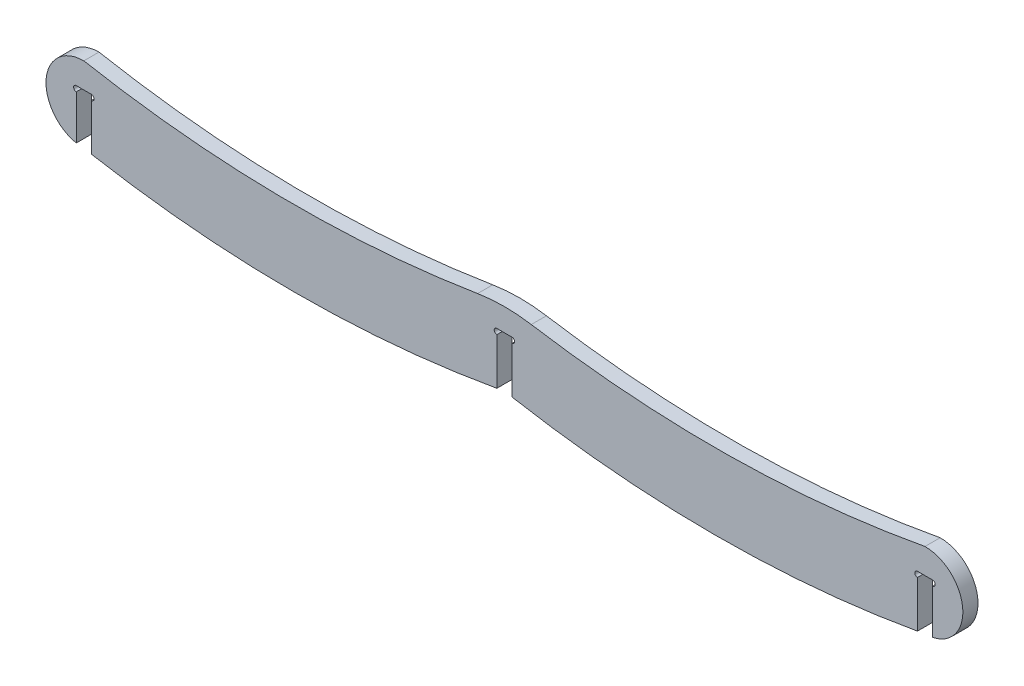
from build123d import *

# Parameters (mm, degrees)
ESTRUSIONE_ESTRUSIONE1_DEPTH = 18
RACCORDO1_R                  = 200


with BuildPart() as part:
    # Schizzo1 → Estrusione-Estrusione1 (new body)
    with BuildSketch(Plane.XY):
        with BuildLine():
            ThreePointArc((-66.988913829, 53.65), (-70.163913829, 56.825), (-66.988913829, 60))
            Line((-66.988913829, 60), (-48.988913829, 60))
            ThreePointArc((-48.988913829, 60), (-45.813913829, 56.825), (-48.988913829, 53.65))
            Line((-48.988913829, 53.65), (-48.988913829, 0.90918463))
            ThreePointArc((-48.988913829, 0.90918463), (-23.132063713, 16.539501058), (-12.988913829, 45))
            ThreePointArc((-12.988913829, 45), (-21.036068748, 70.680483648), (-42.299457846, 87.176308171))
            ThreePointArc((-42.299457846, 87.176308171), (-50.148301569, 88.565285591), (-57.988913829, 90))
            ThreePointArc((-57.988913829, 90), (-102.761040714, 49.52290329), (-66.988913829, 0.90918463))
            Line((-66.988913829, 0.90918463), (-66.988913829, 53.65))
        make_face()
        with BuildLine():
            ThreePointArc((-12.988913829, 45), (-23.132063713, 16.539501058), (-48.988913829, 0.90918463))
            Line((-48.988913829, 0.90918463), (-48.988913829, -1.642858287))
            ThreePointArc((-48.988913829, -1.642858287), (192.011086171, -23.052237245), (433.011086171, -1.642858287))
            Line((433.011086171, -1.642858287), (433.011086171, 0.90918463))
            ThreePointArc((433.011086171, 0.90918463), (397.145771503, 41.520985802), (426.321630188, 87.176308171))
            ThreePointArc((426.321630188, 87.176308171), (192.011086171, 66.947762755), (-42.299457846, 87.176308171))
            ThreePointArc((-42.299457846, 87.176308171), (-21.036068748, 70.680483648), (-12.988913829, 45))
        make_face()
        with BuildLine():
            ThreePointArc((442.011086171, 90), (434.17047391, 88.565285591), (426.321630188, 87.176308171))
            ThreePointArc((426.321630188, 87.176308171), (397.145771503, 41.520985802), (433.011086171, 0.90918463))
            Line((433.011086171, 0.90918463), (433.011086171, 53.65))
            ThreePointArc((433.011086171, 53.65), (429.836086171, 56.825), (433.011086171, 60))
            Line((433.011086171, 60), (451.011086171, 60))
            ThreePointArc((451.011086171, 60), (454.186086171, 56.825), (451.011086171, 53.65))
            Line((451.011086171, 53.65), (451.011086171, 0.90918463))
            ThreePointArc((451.011086171, 0.90918463), (476.867936287, 16.539501058), (487.011086171, 45))
            ThreePointArc((487.011086171, 45), (478.963931252, 70.680483648), (457.700542154, 87.176308171))
            ThreePointArc((457.700542154, 87.176308171), (449.851698431, 88.565285591), (442.011086171, 90))
        make_face()
        with BuildLine():
            ThreePointArc((487.011086171, 45), (476.867936287, 16.539501058), (451.011086171, 0.90918463))
            Line((451.011086171, 0.90918463), (451.011086171, -1.642858287))
            ThreePointArc((451.011086171, -1.642858287), (692.011086171, -23.052237245), (933.011086171, -1.642858287))
            Line((933.011086171, -1.642858287), (933.011086171, 0.90918463))
            ThreePointArc((933.011086171, 0.90918463), (897.145771503, 41.520985802), (926.321630188, 87.176308171))
            ThreePointArc((926.321630188, 87.176308171), (692.011086171, 66.947762755), (457.700542154, 87.176308171))
            ThreePointArc((457.700542154, 87.176308171), (478.963931252, 70.680483648), (487.011086171, 45))
        make_face()
        with BuildLine():
            ThreePointArc((942.011086171, 90), (934.17047391, 88.565285591), (926.321630188, 87.176308171))
            ThreePointArc((926.321630188, 87.176308171), (897.145771503, 41.520985802), (933.011086171, 0.90918463))
            Line((933.011086171, 0.90918463), (933.011086171, 53.65))
            ThreePointArc((933.011086171, 53.65), (929.836086171, 56.825), (933.011086171, 60))
            Line((933.011086171, 60), (951.011086171, 60))
            ThreePointArc((951.011086171, 60), (954.186086171, 56.825), (951.011086171, 53.65))
            Line((951.011086171, 53.65), (951.011086171, 0.90918463))
            ThreePointArc((951.011086171, 0.90918463), (976.867936287, 16.539501058), (987.011086171, 45))
            ThreePointArc((987.011086171, 45), (973.830891324, 76.819805153), (942.011086171, 90))
        make_face()
    extrude(amount=ESTRUSIONE_ESTRUSIONE1_DEPTH)

    # Raccordo1
    raccordo1_edges = [part.edges().sort_by_distance(p)[0] for p in [
        (442.011086171, 90, 9),
    ]]
    fillet(raccordo1_edges, radius=RACCORDO1_R)


solid = part.part
